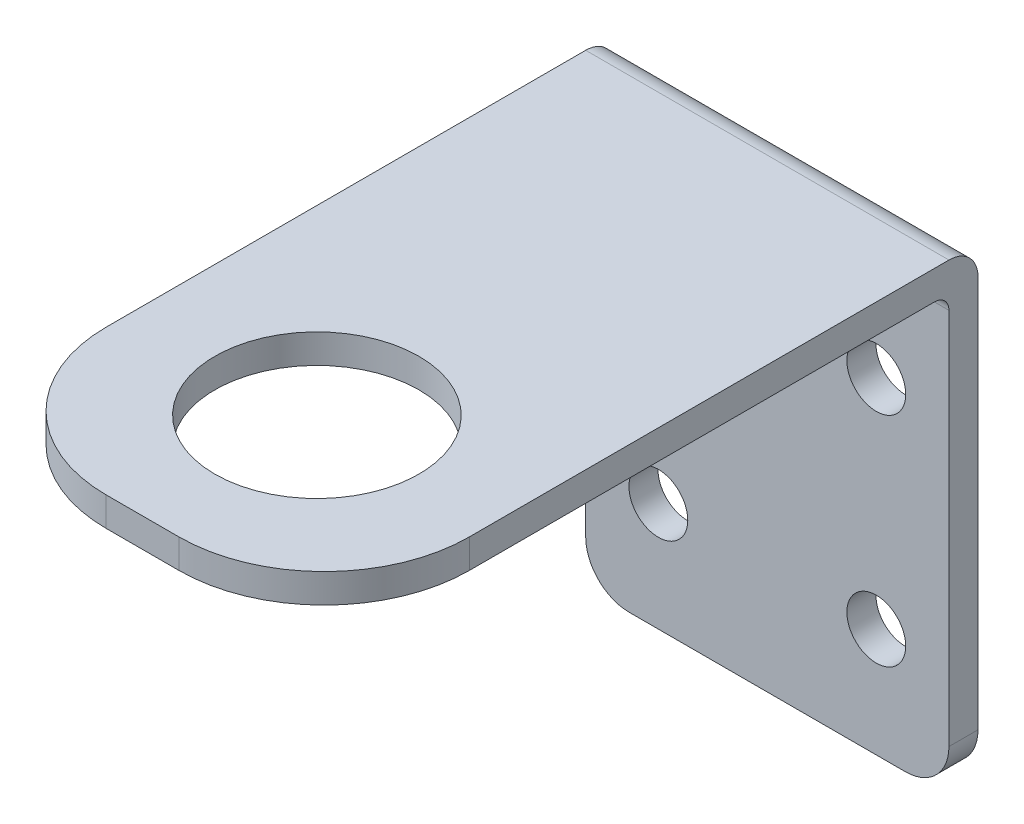
from build123d import *

# Parameters (mm, degrees)
SKETCH1_W           = 25
SKETCH1_H           = 30
BOSS_EXTRUDE1_DEPTH = 2
SKETCH2_R           = 2.025
CUT_EXTRUDE1_DEPTH  = 20.627786426
SKETCH3_W           = 25
SKETCH3_H           = 2
BOSS_EXTRUDE2_DEPTH = 45
FILLET1_R           = 2
FILLET2_R           = 1
SKETCH4_R           = 7.025
CUT_EXTRUDE2_DEPTH  = 57.61492736
FILLET6_R           = 10
FILLET7_R           = 3


with BuildPart() as part:
    # Sketch1 → Boss-Extrude1 (new body)
    with BuildSketch(Plane.XY):
        Rectangle(SKETCH1_W, SKETCH1_H)
    extrude(amount=BOSS_EXTRUDE1_DEPTH)

    # Sketch2 → Cut-Extrude1 (cut, through all)
    with BuildSketch(Plane.XY.offset(2)):
        with Locations((-7.5, 7.5)):
            Circle(SKETCH2_R)
        with Locations((7.5, 7.5)):
            Circle(SKETCH2_R)
        with Locations((7.5, -7.5)):
            Circle(SKETCH2_R)
        with Locations((-7.5, -7.5)):
            Circle(SKETCH2_R)
    extrude(amount=-CUT_EXTRUDE1_DEPTH, mode=Mode.SUBTRACT)

    # Sketch3 → Boss-Extrude2 (add)
    with BuildSketch(Plane(origin=(0, 0, 0), x_dir=(-1, 0, 0), z_dir=(0, 0, -1))):
        with Locations((0, 16)):
            Rectangle(SKETCH3_W, SKETCH3_H)
    extrude(amount=-BOSS_EXTRUDE2_DEPTH)

    # Fillet1
    fillet1_edges = [part.edges().sort_by_distance(p)[0] for p in [
        (0, 17, 0),
    ]]
    fillet(fillet1_edges, radius=FILLET1_R)

    # Fillet2
    fillet2_edges = [part.edges().sort_by_distance(p)[0] for p in [
        (0, 15, 2),
    ]]
    fillet(fillet2_edges, radius=FILLET2_R)

    # Sketch4 → Cut-Extrude2 (cut, through all)
    with BuildSketch(Plane(origin=(0, 17, 0), x_dir=(1, 0, 0), z_dir=(0, 1, 0))):
        with Locations(Location((0, -33, 0), (0, 0, 270))):
            Circle(SKETCH4_R)
    extrude(amount=-CUT_EXTRUDE2_DEPTH, mode=Mode.SUBTRACT)

    # Fillet6
    fillet6_edges = [part.edges().sort_by_distance(p)[0] for p in [
        (12.5, 16, 45),
        (-12.5, 16, 45),
    ]]
    fillet(fillet6_edges, radius=FILLET6_R)

    # Fillet7
    fillet7_edges = [part.edges().sort_by_distance(p)[0] for p in [
        (12.5, -15, 1),
        (-12.5, -15, 1),
    ]]
    fillet(fillet7_edges, radius=FILLET7_R)


solid = part.part
